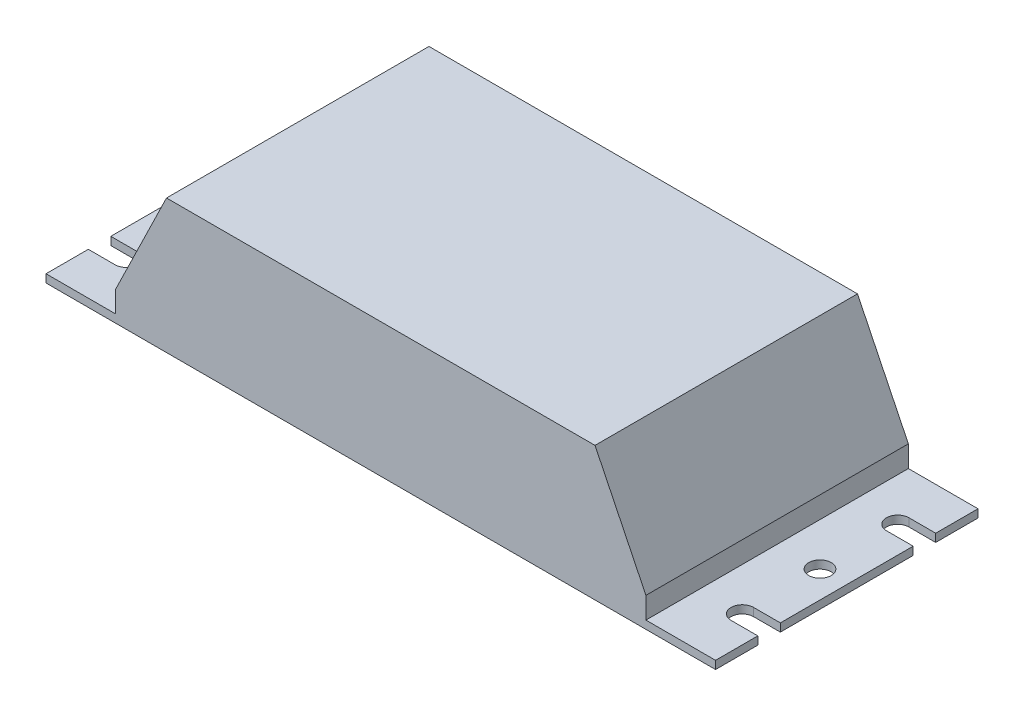
from build123d import *

# Parameters (mm, degrees)
SKETCH_1_W          = 125
SKETCH_1_H          = 49
EXTRUDE_1_DEPTH     = 25
SKETCH_2_OUTSIDE_W  = 154.314
SKETCH_2_OUTSIDE_H  = 54.314
CUT_EXTRUDE_1_DEPTH = 84.260134518
SKETCH_3_R          = 2.1
CUT_EXTRUDE_2_DEPTH = 25


with BuildPart() as part:
    # 草图1 → 凸台-拉伸1 (new body)
    with BuildSketch(Plane(origin=(0, 0, 0), x_dir=(1, 0, 0), z_dir=(0, 1, 0))):
        Rectangle(SKETCH_1_W, SKETCH_1_H)
    extrude(amount=EXTRUDE_1_DEPTH)

    # 草图2 outside → 切除-拉伸1 (cut, through all)
    with BuildSketch(Plane.XY.offset(24.5)):
        with Locations((0, 12.5)):
            Rectangle(SKETCH_2_OUTSIDE_W, SKETCH_2_OUTSIDE_H)
        Polygon((-62.5, 1.5), (-49.5, 1.5), (-49.5, 5.5), (-40, 25), (40, 25), (49.5, 5.5), (49.5, 1.5), (62.5, 1.5), (62.5, 0), (-62.5, 0), align=None, mode=Mode.SUBTRACT)
    extrude(amount=-CUT_EXTRUDE_1_DEPTH, mode=Mode.SUBTRACT)

    # 草图3 → 切除-拉伸2 (cut)
    with BuildSketch(Plane.XZ):
        with Locations(Location((-57.5, 0, 0), (0, 0, 270))):
            Circle(SKETCH_3_R)
        with Locations(Location((57.5, 0, 0), (0, 0, 180))):
            Circle(SKETCH_3_R)
        with BuildLine():
            Line((-62.5, 16.6), (-57.5, 16.6))
            ThreePointArc((-57.5, 16.6), (-55.4, 14.5), (-57.5, 12.4))
            Line((-57.5, 12.4), (-62.5, 12.4))
            Line((-62.5, 12.4), (-62.5, 16.6))
        make_face()
        with BuildLine():
            Line((62.5, 16.6), (62.5, 12.4))
            Line((62.5, 12.4), (57.5, 12.4))
            ThreePointArc((57.5, 12.4), (55.4, 14.5), (57.5, 16.6))
            Line((57.5, 16.6), (62.5, 16.6))
        make_face()
        with BuildLine():
            Line((62.5, -16.6), (57.5, -16.6))
            ThreePointArc((57.5, -16.6), (55.4, -14.5), (57.5, -12.4))
            Line((57.5, -12.4), (62.5, -12.4))
            Line((62.5, -12.4), (62.5, -16.6))
        make_face()
        with BuildLine():
            Line((-62.5, -16.6), (-62.5, -12.4))
            Line((-62.5, -12.4), (-57.5, -12.4))
            ThreePointArc((-57.5, -12.4), (-55.4, -14.5), (-57.5, -16.6))
            Line((-57.5, -16.6), (-62.5, -16.6))
        make_face()
    extrude(amount=-CUT_EXTRUDE_2_DEPTH, mode=Mode.SUBTRACT)


solid = part.part
